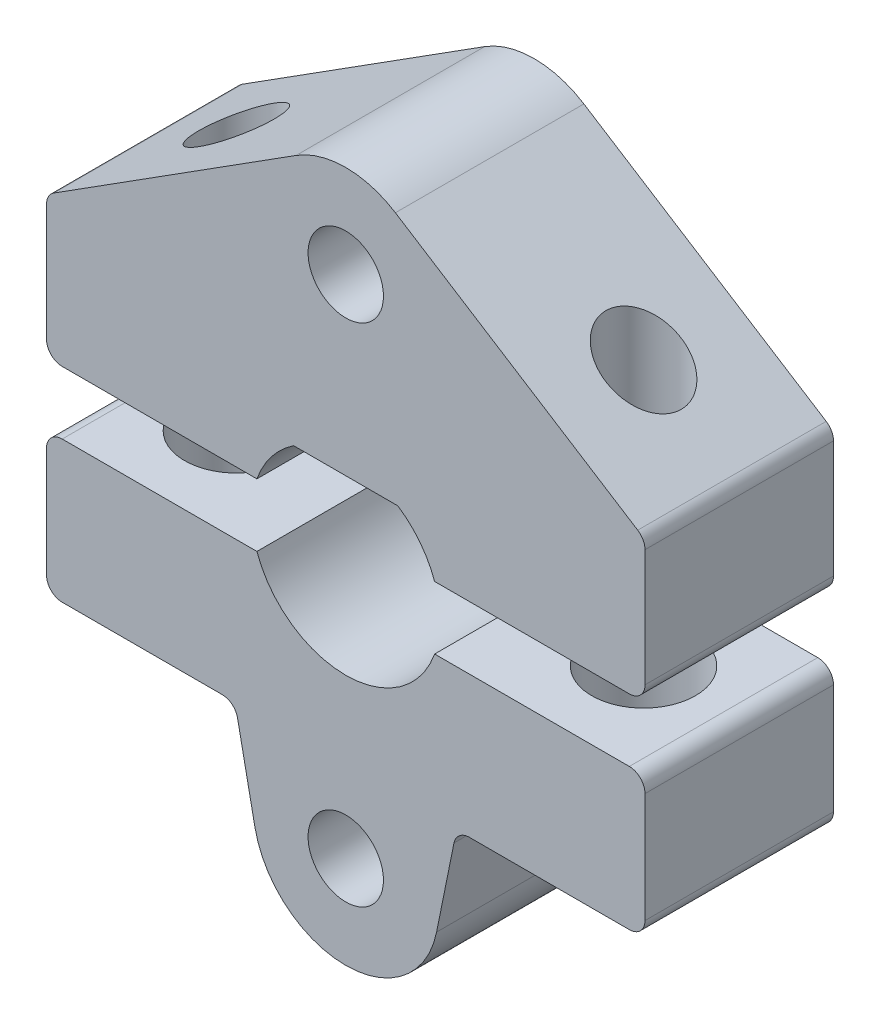
from build123d import *

# Parameters (mm, degrees)
SKETCH_1_R          = 1.2
EXTRUDE_1_DEPTH     = 3
EXTRUDE_1_2_DEPTH   = 3
SKETCH_2_R          = 1.2
CUT_EXTRUDE_1_DEPTH = 20.287301522
SKETCH_3_R          = 1.65
CUT_EXTRUDE_2_DEPTH = 4.5


with BuildPart() as part:
    # 草图1 → 凸台-拉伸1 (new, symmetric)
    with BuildSketch(Plane.XY):
        with BuildLine():
            Line((-1.658312395, 2.5), (1.658312395, 2.5))
            ThreePointArc((1.658312395, 2.5), (2.365419176, 1.84520788), (2.828427125, 1))
            Line((2.828427125, 1), (9.026279442, 1))
            ThreePointArc((9.026279442, 1), (9.379832832, 1.146446609), (9.526279442, 1.5))
            Line((9.526279442, 1.5), (9.526279442, 5.22507425))
            ThreePointArc((9.526279442, 5.22507425), (9.464414867, 5.465983671), (9.294130046, 5.647278056))
            Line((9.294130046, 5.647278056), (1.580318565, 10.541002455))
            ThreePointArc((1.580318565, 10.541002455), (0, 11), (-1.580318565, 10.541002455))
            Line((-1.580318565, 10.541002455), (-9.294130046, 5.647278056))
            ThreePointArc((-9.294130046, 5.647278056), (-9.464414867, 5.465983671), (-9.526279442, 5.22507425))
            Line((-9.526279442, 5.22507425), (-9.526279442, 1.5))
            ThreePointArc((-9.526279442, 1.5), (-9.379832832, 1.146446609), (-9.026279442, 1))
            Line((-9.026279442, 1), (-2.828427125, 1))
            ThreePointArc((-2.828427125, 1), (-2.365419176, 1.84520788), (-1.658312395, 2.5))
        make_face()
        with Locations((0, 8.05)):
            Circle(SKETCH_1_R, mode=Mode.SUBTRACT)
    extrude(amount=EXTRUDE_1_DEPTH, both=True)


with BuildPart() as body_2:
    # 草图1 → Extrude 1 2 (new, symmetric)
    with BuildSketch(Plane.XY):
        with BuildLine():
            Line((-9.026279442, -1), (-2.828427125, -1))
            ThreePointArc((-2.828427125, -1), (0, -3), (2.828427125, -1))
            Line((2.828427125, -1), (9.026279442, -1))
            ThreePointArc((9.026279442, -1), (9.379832832, -1.146446609), (9.526279442, -1.5))
            Line((9.526279442, -1.5), (9.526279442, -5))
            ThreePointArc((9.526279442, -5), (9.379832832, -5.353553391), (9.026279442, -5.5))
            Line((9.026279442, -5.5), (3.935174447, -5.5))
            ThreePointArc((3.935174447, -5.5), (3.6186464, -5.612947037), (3.445121974, -5.900760016))
            Line((3.445121974, -5.900760016), (2.891309587, -8.635515904))
            ThreePointArc((2.891309587, -8.635515904), (0, -11), (-2.891309587, -8.635515904))
            Line((-2.891309587, -8.635515904), (-3.445121974, -5.900760016))
            ThreePointArc((-3.445121974, -5.900760016), (-3.6186464, -5.612947037), (-3.935174447, -5.5))
            Line((-3.935174447, -5.5), (-9.026279442, -5.5))
            ThreePointArc((-9.026279442, -5.5), (-9.379832832, -5.353553391), (-9.526279442, -5))
            Line((-9.526279442, -5), (-9.526279442, -1.5))
            ThreePointArc((-9.526279442, -1.5), (-9.379832832, -1.146446609), (-9.026279442, -1))
        make_face()
        with Locations((0, -8.05)):
            Circle(SKETCH_1_R, mode=Mode.SUBTRACT)
    extrude(amount=EXTRUDE_1_2_DEPTH, both=True)


with BuildPart() as cut_extrude_1_tool:
    # 草图2 → 切除-拉伸1 (new, through all)
    with BuildSketch(Plane.XZ.offset(5.5)):
        with Locations(Location((6.480726944, 0, 0), (0, 0, 270))):
            Circle(SKETCH_2_R)
        with Locations(Location((-6.480726944, 0, 0), (0, 0, 270))):
            Circle(SKETCH_2_R)
    extrude(amount=-CUT_EXTRUDE_1_DEPTH)


with BuildPart() as part_1:
    add(part.part)

    # 切除-拉伸1: cut by cut_extrude_1_tool
    add(cut_extrude_1_tool.part, mode=Mode.SUBTRACT)


with BuildPart() as body_2_1:
    add(body_2.part)

    # 切除-拉伸1: cut by cut_extrude_1_tool
    add(cut_extrude_1_tool.part, mode=Mode.SUBTRACT)

    # 草图3 → 切除-拉伸2 (cut)
    with BuildSketch(Plane.XZ.offset(5.5)):
        with Locations(Location((-6.480726944, 0, 0), (0, 0, 270))):
            Circle(SKETCH_3_R)
        with Locations(Location((6.480726944, 0, 0), (0, 0, 270))):
            Circle(SKETCH_3_R)
    extrude(amount=-CUT_EXTRUDE_2_DEPTH, mode=Mode.SUBTRACT)


solid = Compound([part_1.part, body_2_1.part])
